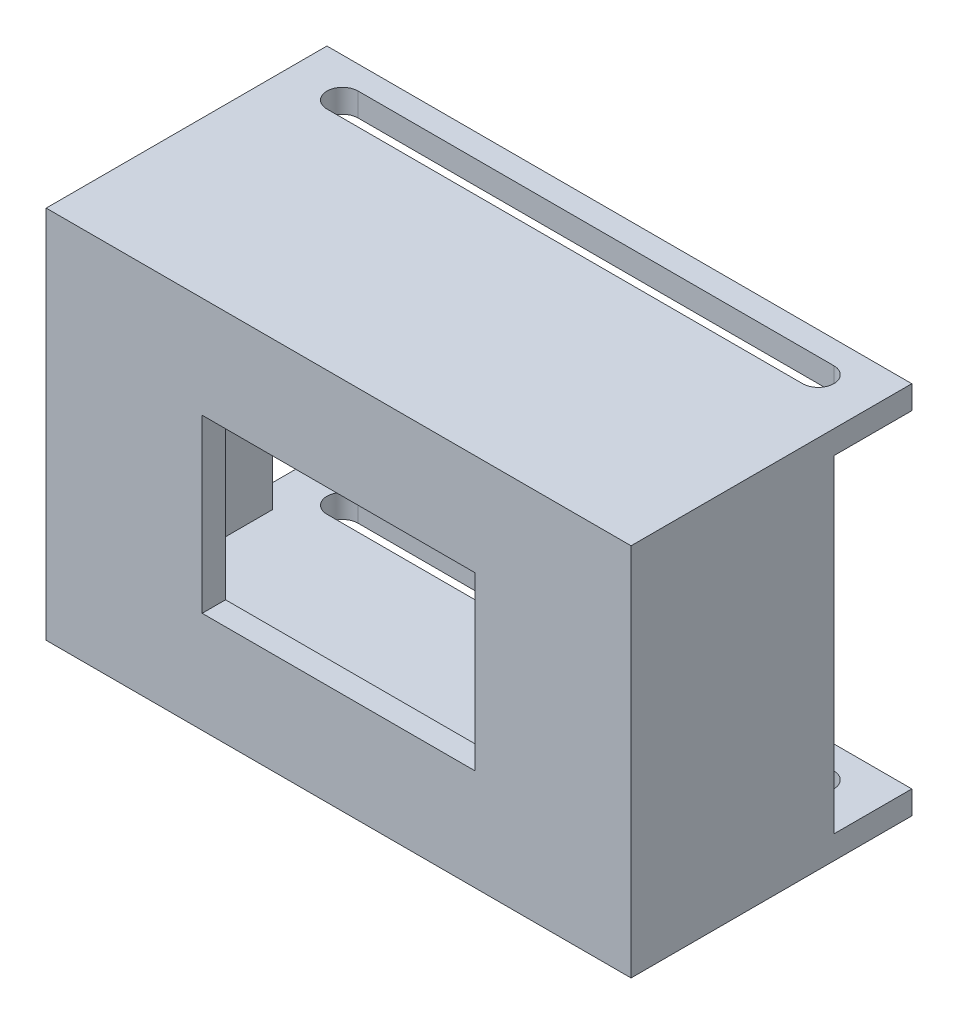
from build123d import *

# Parameters (mm, degrees)
SKETCH1_W           = 75
SKETCH1_H           = 48
BOSS_EXTRUDE1_DEPTH = 3
SKETCH2_W           = 35
SKETCH2_H           = 22
CUT_EXTRUDE1_DEPTH  = 3
SKETCH3_W           = 75
SKETCH3_H           = 3
BOSS_EXTRUDE2_DEPTH = 33
SKETCH4_W           = 3
SKETCH4_H           = 42
BOSS_EXTRUDE3_DEPTH = 23
CUT_EXTRUDE2_DEPTH  = 70.276619433


with BuildPart() as part:
    # Sketch1 → Boss-Extrude1 (new body)
    with BuildSketch(Plane.XY):
        Rectangle(SKETCH1_W, SKETCH1_H)
    extrude(amount=BOSS_EXTRUDE1_DEPTH)

    # Sketch2 → Cut-Extrude1 (cut)
    with BuildSketch(Plane.XY.offset(3)):
        Rectangle(SKETCH2_W, SKETCH2_H)
    extrude(amount=-CUT_EXTRUDE1_DEPTH, mode=Mode.SUBTRACT)

    # Sketch3 → Boss-Extrude2 (add)
    with BuildSketch(Plane(origin=(0, 0, 0), x_dir=(-1, 0, 0), z_dir=(0, 0, -1))):
        with Locations((0, 22.5)):
            Rectangle(SKETCH3_W, SKETCH3_H)
        with Locations((0, -22.5)):
            Rectangle(SKETCH3_W, SKETCH3_H)
    extrude(amount=BOSS_EXTRUDE2_DEPTH)

    # Sketch4 → Boss-Extrude3 (add)
    with BuildSketch(Plane(origin=(0, 0, 0), x_dir=(-1, 0, 0), z_dir=(0, 0, -1))):
        with Locations((-36, 0)):
            Rectangle(SKETCH4_W, SKETCH4_H)
        with Locations((36, 0)):
            Rectangle(SKETCH4_W, SKETCH4_H)
    extrude(amount=BOSS_EXTRUDE3_DEPTH)

    # Sketch5 → Cut-Extrude2 (cut, through all)
    with BuildSketch(Plane.XZ.offset(24)):
        with BuildLine():
            Line((-30.5, -26), (30.5, -26))
            ThreePointArc((30.5, -26), (32.5, -28), (30.5, -30))
            Line((30.5, -30), (-30.5, -30))
            ThreePointArc((-30.5, -30), (-32.5, -28), (-30.5, -26))
        make_face()
    extrude(amount=-CUT_EXTRUDE2_DEPTH, mode=Mode.SUBTRACT)


solid = part.part
